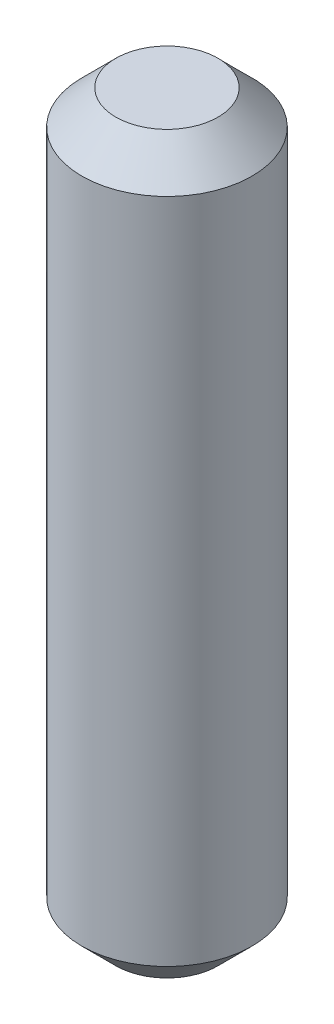
from build123d import *

# Parameters (mm, degrees)
SKETCH1_R           = 2.5
BOSS_EXTRUDE1_DEPTH = 21.59
CHAMFER1_SIZE       = 1


with BuildPart() as part:
    # Sketch1 → Boss-Extrude1 (new body)
    with BuildSketch(Plane(origin=(0, 0, 0), x_dir=(1, 0, 0), z_dir=(0, 1, 0))):
        with Locations(Location((0, 0, 0), (0, 0, 270))):
            Circle(SKETCH1_R)
    extrude(amount=BOSS_EXTRUDE1_DEPTH)

    # Chamfer1
    chamfer1_edges = [part.edges().sort_by_distance(p)[0] for p in [
        (0, 0, -2.5),
        (0, 21.59, -2.5),
    ]]
    chamfer(chamfer1_edges, length=CHAMFER1_SIZE)


solid = part.part
